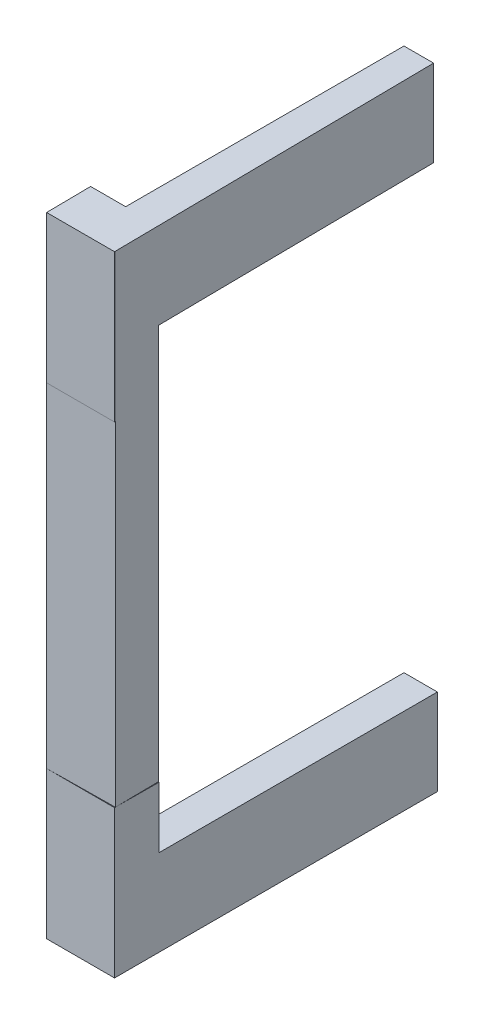
from build123d import *

# Parameters (mm, degrees)
BOSS_EXTRUDE1_DEPTH      = 30
SKETCH3_R                = 4
CUT_EXTRUDE1_DEPTH       = 40
SKETCH4_W                = 3
SKETCH4_H                = 41
BOSS_EXTRUDE2_DEPTH      = 4
BOSS_EXTRUDE3_DEPTH      = 25
BOSS_EXTRUDE3_DEPTH_BACK = 4
SKETCH5_W                = 3
SKETCH5_H                = 7.75
BOSS_EXTRUDE4_REACH      = 69.734
SKETCH6_W                = 4
SKETCH6_H                = 56.5
CUT_EXTRUDE3_DEPTH       = 47
CUT_EXTRUDE4_DEPTH       = 47


with BuildPart() as part:
    # Sketch1 → Boss-Extrude1 (new body)
    with BuildSketch(Plane(origin=(0, 0, 0), x_dir=(1, 0, 0), z_dir=(0, 1, 0))):
        Polygon((-12.8, -12.8), (-13.1, 12.8), (13.1, 12.8), (12.8, -12.6), (16.799721029, -12.6472408), (17.147523085, 16.8), (-17.147149649, 16.8), (-16.79972537, -12.846871782), align=None)
    extrude(amount=BOSS_EXTRUDE1_DEPTH)

    # Sketch3 → Cut-Extrude1 (cut)
    with BuildSketch(Plane(origin=(16.946733814, 0, 0.200158273), x_dir=(0.011810199887684227, 0, -0.9999302571572745), z_dir=(0.9999302571572745, 0, 0.011810199887684227))):
        with Locations(Location((-0.747950682, 15, 0), (0, 0, 180))):
            Circle(SKETCH3_R)
    extrude(amount=-CUT_EXTRUDE1_DEPTH, mode=Mode.SUBTRACT)

    # Sketch4 → Boss-Extrude2 (add)
    with BuildSketch(Plane(origin=(0, 0, -16.8), x_dir=(-1, 0, 0), z_dir=(0, 0, -1))):
        with Locations((12.499813282, 15)):
            Rectangle(SKETCH4_W, SKETCH4_H)
    extrude(amount=-BOSS_EXTRUDE2_DEPTH)

    # Sketch5 → Boss-Extrude3 (add, two sides: drawn at the far end of the back side and taken through both)
    with BuildSketch(Plane(origin=(0, 0, -16.8), x_dir=(-1, 0, 0), z_dir=(0, 0, -1)).offset(-BOSS_EXTRUDE3_DEPTH_BACK)):
        with Locations((12.499813282, 39.375)):
            Rectangle(SKETCH5_W, SKETCH5_H)
        with Locations((12.499813282, -9.375)):
            Rectangle(SKETCH5_W, SKETCH5_H)
    extrude(amount=BOSS_EXTRUDE3_DEPTH + BOSS_EXTRUDE3_DEPTH_BACK)

    # Boss-Extrude4: up to this plane
    boss_extrude4_end = Plane(origin=(-16.79972537, 30, 12.846871782), z_dir=(0.9999313425206403, 0, -0.01171794542016394))
    # Sketch6 → Boss-Extrude4 (add, up to the surface)
    with BuildSketch(Plane.ZY.offset(13.999813282), mode=Mode.PRIVATE) as boss_extrude4_sk1:
        with Locations((-14.8, 15)):
            Rectangle(SKETCH6_W, SKETCH6_H)
    boss_extrude4_tool1 = split(extrude(boss_extrude4_sk1.sketch, amount=BOSS_EXTRUDE4_REACH, mode=Mode.PRIVATE), bisect_by=boss_extrude4_end, keep=Keep.BOTH, mode=Mode.PRIVATE)
    add(boss_extrude4_tool1.solids().sort_by_distance((-13.999813, 15, -14.8))[0])

    # Sketch7 → Cut-Extrude3 (cut)
    with BuildSketch(Plane(origin=(-16.947947202, 0, 0.198608756), x_dir=(0.01171794542016394, 0, 0.9999313425206403), z_dir=(-0.9999313425206403, 0, 0.01171794542016394))):
        Polygon((15.81172836, 30), (-12.999501269, 30), (-12.999501269, 0), (19.011921217, 0), align=None)
    extrude(amount=-CUT_EXTRUDE3_DEPTH, mode=Mode.SUBTRACT)

    # Sketch8 → Cut-Extrude4 (cut)
    with BuildSketch(Plane(origin=(-0.152327446, 0, -12.998608756), x_dir=(0.9999313425206403, 0, -0.011717945420163944), z_dir=(0.011717945420163944, 0, 0.9999313425206403))):
        Polygon((-10.848230648, 0), (-10.848230648, 46.508852654), (34.891429073, 42.782410239), (32.959466486, 0), (23.967074224, -10.626450369), align=None)
    extrude(amount=-CUT_EXTRUDE4_DEPTH, mode=Mode.SUBTRACT)


solid = part.part
